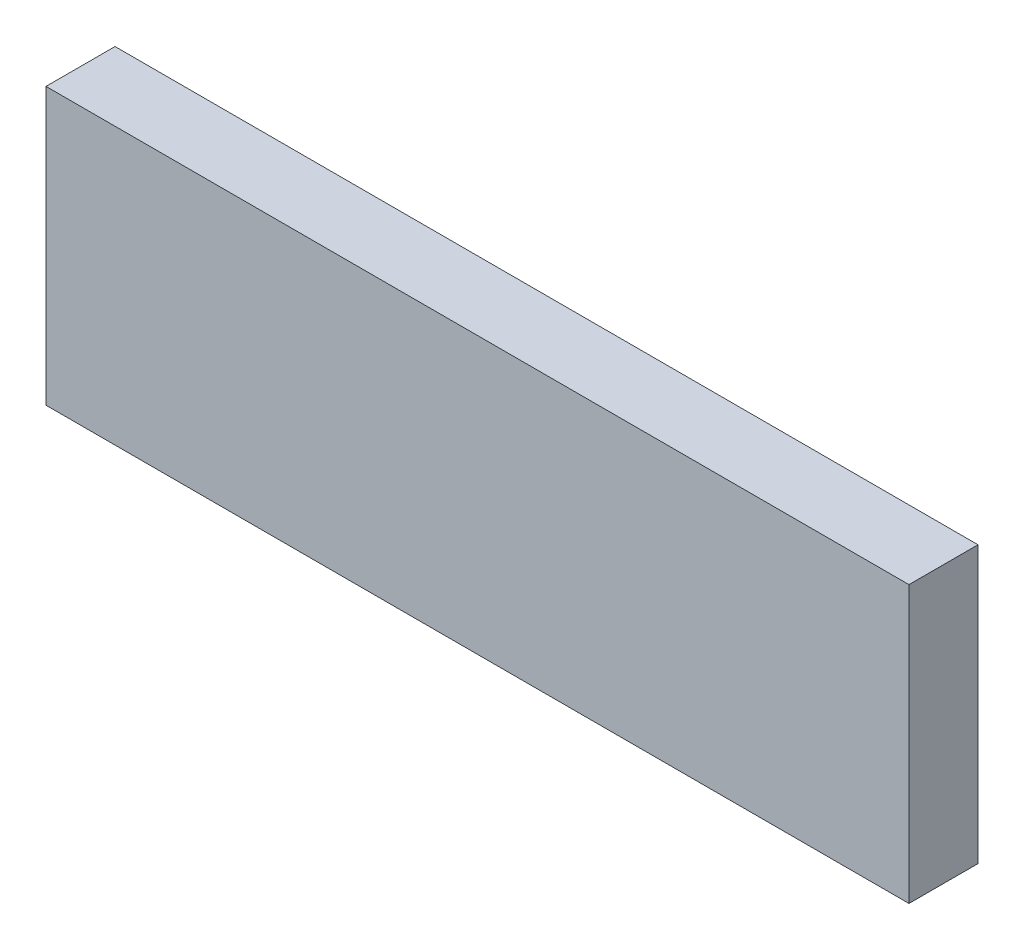
from build123d import *

# Parameters (mm, degrees)
SKETCH1_W           = 31.75
SKETCH1_H           = 10.16
BOSS_EXTRUDE1_DEPTH = 2.54


with BuildPart() as part:
    # Sketch1 → Boss-Extrude1 (new body)
    with BuildSketch(Plane.XY):
        Rectangle(SKETCH1_W, SKETCH1_H)
    extrude(amount=BOSS_EXTRUDE1_DEPTH)


solid = part.part
